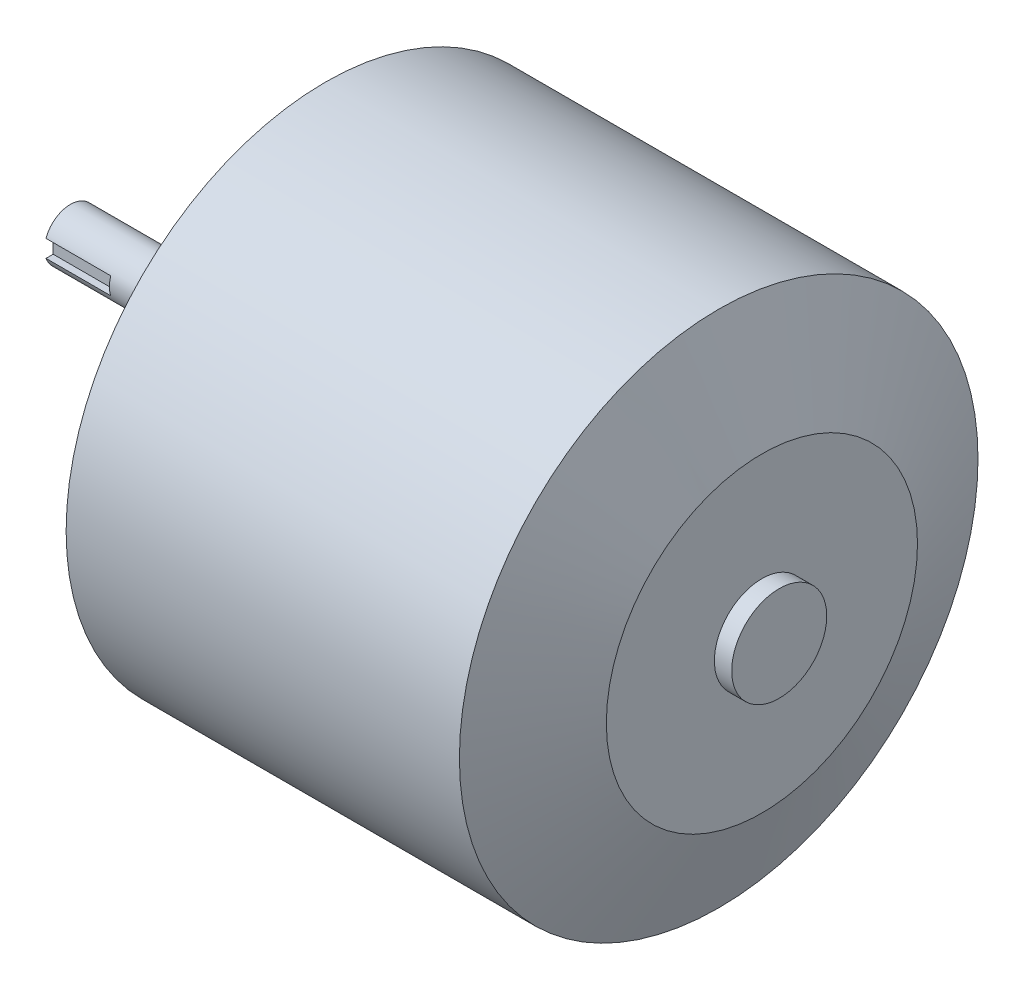
from build123d import *

# Parameters (mm, degrees)
BOSS_EXTRUDE1_START = 4
SKETCH1_R           = 60
BOSS_EXTRUDE1_DEPTH = 91
SKETCH3_R           = 47.5
SKETCH3_R_2         = 2.25
BOSS_EXTRUDE2_DEPTH = 4
SKETCH4_R           = 6
BOSS_EXTRUDE3_DEPTH = 55
CUT_EXTRUDE1_START  = -15
CUT_EXTRUDE1_DEPTH  = 15


with BuildPart() as part:
    # Sketch1 → Boss-Extrude1 (new body)
    with BuildSketch(Plane(origin=(0, 0, 0), x_dir=(0, 0, -1), z_dir=(1, 0, 0)).offset(BOSS_EXTRUDE1_START)):
        Circle(SKETCH1_R)
    extrude(amount=BOSS_EXTRUDE1_DEPTH)

    # Sketch2 → Revolve1 (revolve)
    with BuildSketch(Plane.XY):
        Polygon((95, 60), (105, 36), (105, 11), (109, 11), (109, 0), (105, 0), (95, 0), align=None)
    revolve(axis=Axis((95, 0, 0), (-1, 0, 0)))

    # Sketch3 → Boss-Extrude2 (add)
    with BuildSketch(Plane.ZY.offset(-4)):
        Circle(SKETCH3_R)
        with Locations((21.213203436, -21.213203436)):
            Circle(SKETCH3_R_2, mode=Mode.SUBTRACT)
        with Locations((-21.213203436, -21.213203436)):
            Circle(SKETCH3_R_2, mode=Mode.SUBTRACT)
        with Locations((-28.977774789, -7.764571353)):
            Circle(SKETCH3_R_2, mode=Mode.SUBTRACT)
        with Locations((-28.977774789, 7.764571353)):
            Circle(SKETCH3_R_2, mode=Mode.SUBTRACT)
        with Locations((-21.213203436, 21.213203436)):
            Circle(SKETCH3_R_2, mode=Mode.SUBTRACT)
        with Locations((-7.764571353, 28.977774789)):
            Circle(SKETCH3_R_2, mode=Mode.SUBTRACT)
        with Locations((7.764571353, 28.977774789)):
            Circle(SKETCH3_R_2, mode=Mode.SUBTRACT)
        with Locations((21.213203436, 21.213203436)):
            Circle(SKETCH3_R_2, mode=Mode.SUBTRACT)
        with Locations((28.977774789, 7.764571353)):
            Circle(SKETCH3_R_2, mode=Mode.SUBTRACT)
        with Locations((28.977774789, -7.764571353)):
            Circle(SKETCH3_R_2, mode=Mode.SUBTRACT)
    extrude(amount=BOSS_EXTRUDE2_DEPTH)

    # Sketch4 → Boss-Extrude3 (add)
    with BuildSketch(Plane.ZY):
        Circle(SKETCH4_R)
    extrude(amount=BOSS_EXTRUDE3_DEPTH)

    # Sketch5 → Cut-Extrude1 (cut)
    with BuildSketch(Plane.ZY.offset(55).offset(CUT_EXTRUDE1_START)):
        with BuildLine():
            Line((5.656854249, 2), (4, 2))
            Line((4, 2), (4, -2))
            Line((4, -2), (5.656854249, -2))
            ThreePointArc((5.656854249, -2), (6, 0), (5.656854249, 2))
        make_face()
    extrude(amount=CUT_EXTRUDE1_DEPTH, mode=Mode.SUBTRACT)


solid = part.part
